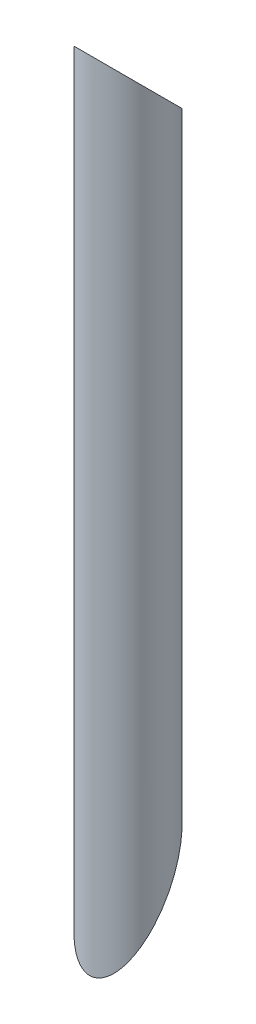
from build123d import *

# Parameters (mm, degrees)
SKETCH1_R           = 6.35
SKETCH1_R_2         = 4.7625
BOSS_EXTRUDE1_DEPTH = 132.08
CUT_EXTRUDE1_DEPTH  = 66.04


with BuildPart() as part:
    # Sketch1 → Boss-Extrude1 (new body)
    with BuildSketch(Plane(origin=(0, 0, 0), x_dir=(1, 0, 0), z_dir=(0, 1, 0))):
        with Locations(Location((0, 0, 0), (0, 0, 270))):
            Circle(SKETCH1_R)
        with Locations(Location((0, 0, 0), (0, 0, 270))):
            Circle(SKETCH1_R_2, mode=Mode.SUBTRACT)
    extrude(amount=BOSS_EXTRUDE1_DEPTH)

    # Sketch2 → Cut-Extrude1 (cut, symmetric)
    with BuildSketch(Plane(origin=(0, 0, 0), x_dir=(0, 0, -1), z_dir=(1, 0, 0))):
        Polygon((-6.35, 132.08), (6.35, 119.38), (6.35, 132.08), align=None)
        Polygon((-6.35, 0), (6.35, 21.997045256), (6.35, 0), align=None)
    extrude(amount=CUT_EXTRUDE1_DEPTH, both=True, mode=Mode.SUBTRACT)


solid = part.part
